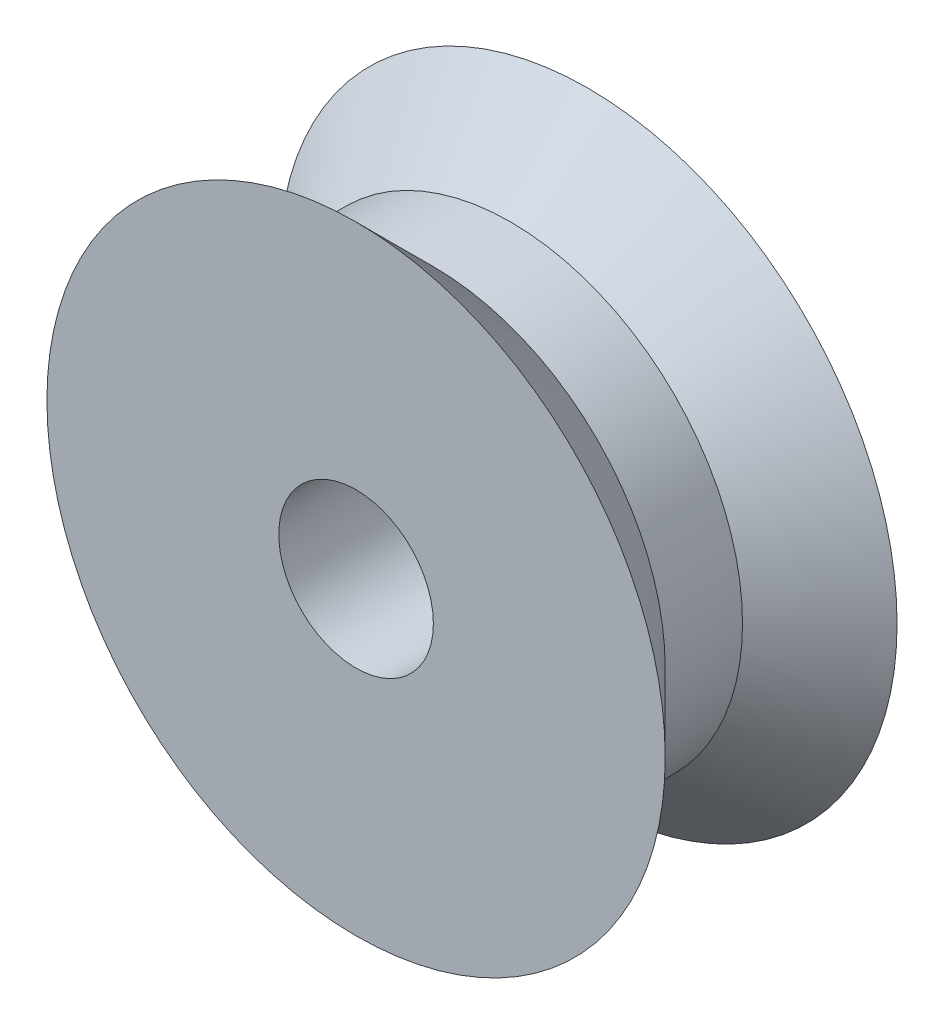
from build123d import *

# Parameters (mm, degrees)
SKETCH1_R           = 40
SKETCH1_R_2         = 10
BOSS_EXTRUDE1_DEPTH = 30


with BuildPart() as part:
    # Sketch1 → Boss-Extrude1 (new body)
    with BuildSketch(Plane.XY):
        Circle(SKETCH1_R)
        Circle(SKETCH1_R_2, mode=Mode.SUBTRACT)
    extrude(amount=BOSS_EXTRUDE1_DEPTH)

    # Sketch2 → Cut-Revolve1 (revolve, cut)
    with BuildSketch(Plane(origin=(0, 0, 0), x_dir=(1, 0, 0), z_dir=(0, 1, 0)), mode=Mode.PRIVATE) as cut_revolve1_sk:
        Polygon((40, -30), (40, 0), (30, -10), (30, -20), align=None)
    revolve(cut_revolve1_sk.sketch.rotate(Axis((0, 0, 0), (0, 0, 1)), 180), axis=Axis((0, 0, 0), (0, 0, 1)), mode=Mode.SUBTRACT)


solid = part.part
